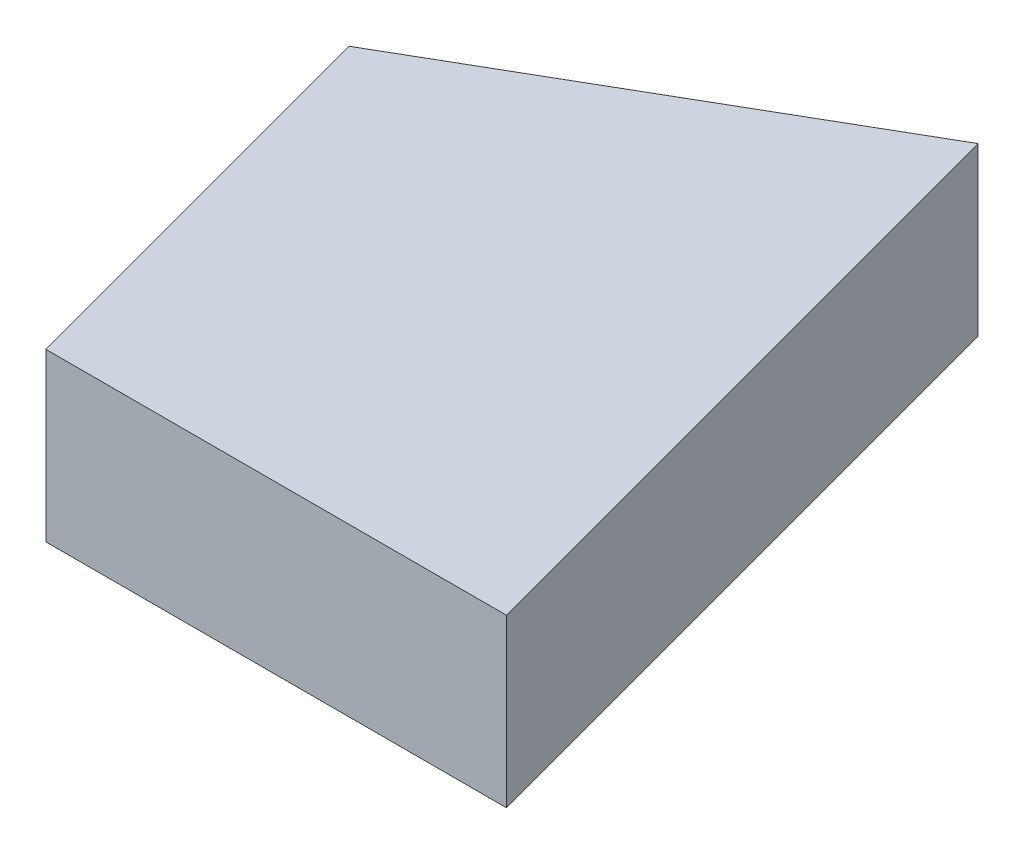
from build123d import *

# Parameters (mm, degrees)
BOSS_EXTRUDE1_DEPTH = 19.05


with BuildPart() as part:
    # Sketch1 → Boss-Extrude1 (new body)
    with BuildSketch(Plane(origin=(0, 0, 0), x_dir=(1, 0, 0), z_dir=(0, 1, 0))):
        Polygon((147.207095926, 0), (127.48508469, 73.603547963), (81.939050704, 47.307532981), (94.615065962, 0), align=None)
    extrude(amount=BOSS_EXTRUDE1_DEPTH)


solid = part.part
